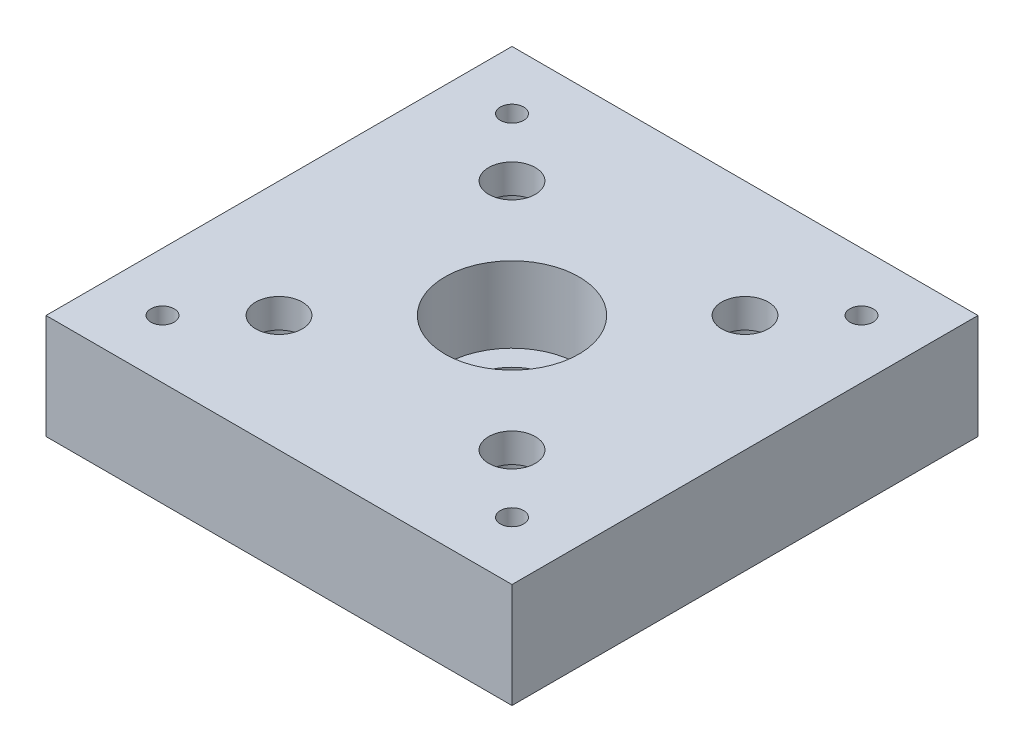
from build123d import *

# Parameters (mm, degrees)
SKETCH_1_W          = 16
SKETCH_1_H          = 16
SKETCH_1_R          = 1.5
SKETCH_1_R_2        = 0.8
SKETCH_1_R_3        = 0.4
EXTRUDE_1_DEPTH     = 3.6
CUT_EXTRUDE_START   = 3.6
SKETCH_1_3_R        = 2.3
CUT_EXTRUDE_1_DEPTH = 2.6
SKETCH_1_4_R        = 1
CUT_EXTRUDE_2_DEPTH = 2.6


with BuildPart() as part:
    # 草图1 → 凸台-拉伸1 (new body)
    with BuildSketch(Plane(origin=(0, 0, 0), x_dir=(1, 0, 0), z_dir=(0, 1, 0))):
        Rectangle(SKETCH_1_W, SKETCH_1_H)
        with Locations(Location((0, 0, 0), (0, 0, 270))):
            Circle(SKETCH_1_R, mode=Mode.SUBTRACT)
        with Locations(Location((-4, 4, 0), (0, 0, 270))):
            Circle(SKETCH_1_R_2, mode=Mode.SUBTRACT)
        with Locations(Location((4, 4, 0), (0, 0, 270))):
            Circle(SKETCH_1_R_2, mode=Mode.SUBTRACT)
        with Locations(Location((-4, -4, 0), (0, 0, 270))):
            Circle(SKETCH_1_R_2, mode=Mode.SUBTRACT)
        with Locations(Location((4, -4, 0), (0, 0, 270))):
            Circle(SKETCH_1_R_2, mode=Mode.SUBTRACT)
        with Locations(Location((-6, 6, 0), (0, 0, 270))):
            Circle(SKETCH_1_R_3, mode=Mode.SUBTRACT)
        with Locations(Location((6, 6, 0), (0, 0, 270))):
            Circle(SKETCH_1_R_3, mode=Mode.SUBTRACT)
        with Locations(Location((6, -6, 0), (0, 0, 270))):
            Circle(SKETCH_1_R_3, mode=Mode.SUBTRACT)
        with Locations(Location((-6, -6, 0), (0, 0, 270))):
            Circle(SKETCH_1_R_3, mode=Mode.SUBTRACT)
    extrude(amount=EXTRUDE_1_DEPTH)

    # 草图1<3> → 切除-拉伸1 (cut)
    with BuildSketch(Plane(origin=(0, 0, 0), x_dir=(1, 0, 0), z_dir=(0, 1, 0)).offset(CUT_EXTRUDE_START)):
        with Locations(Location((0, 0, 0), (0, 0, 270))):
            Circle(SKETCH_1_3_R)
    extrude(amount=-CUT_EXTRUDE_1_DEPTH, mode=Mode.SUBTRACT)

    # 草图1<4> → 切除-拉伸2 (cut)
    with BuildSketch(Plane(origin=(0, 0, 0), x_dir=(1, 0, 0), z_dir=(0, 1, 0))):
        with Locations(Location((-4, 4, 0), (0, 0, 270))):
            Circle(SKETCH_1_4_R)
        with Locations(Location((4, 4, 0), (0, 0, 270))):
            Circle(SKETCH_1_4_R)
        with Locations(Location((4, -4, 0), (0, 0, 270))):
            Circle(SKETCH_1_4_R)
        with Locations(Location((-4, -4, 0), (0, 0, 270))):
            Circle(SKETCH_1_4_R)
    extrude(amount=CUT_EXTRUDE_2_DEPTH, mode=Mode.SUBTRACT)


solid = part.part
